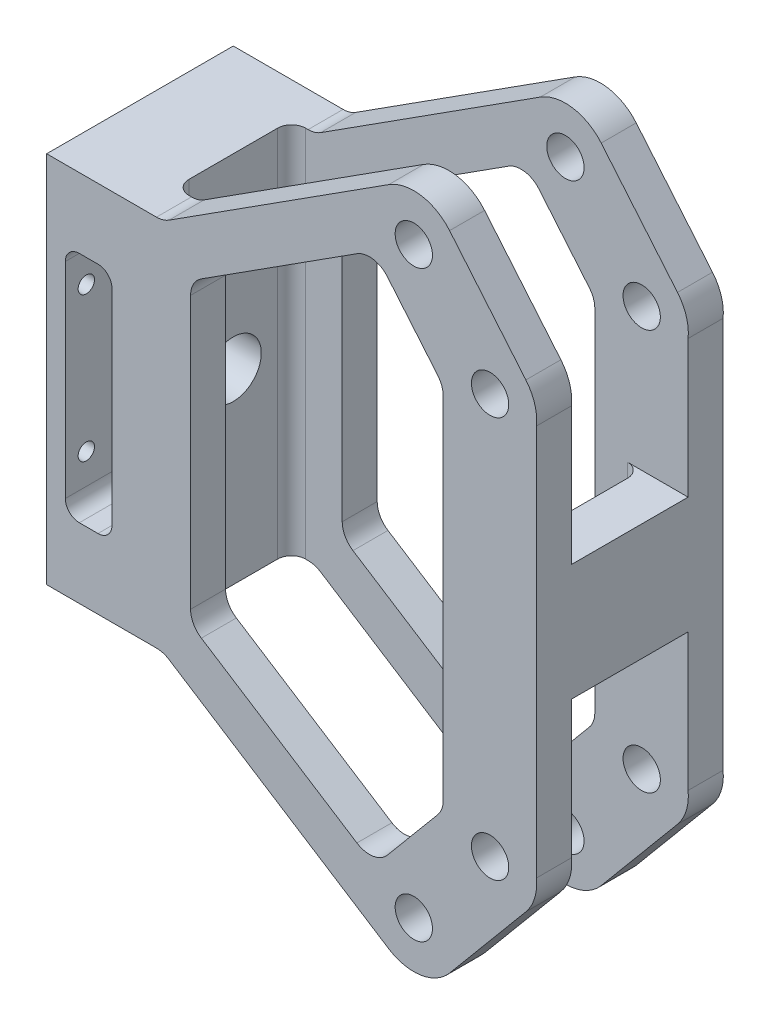
from build123d import *

# Parameters (mm, degrees)
SKETCH1_R               = 4
BOSS_EXTRUDE1_DEPTH     = 40
CUT_EXTRUDE1_DEPTH      = 160.033809299
CUT_EXTRUDE1_DEPTH_BACK = 160.033809299
SKETCH2_W               = 100
SKETCH2_H               = 25
SKETCH3_W               = 25
SKETCH3_H               = 25
BOSS_EXTRUDE2_DEPTH     = 10
SKETCH4_R               = 6
CUT_EXTRUDE2_DEPTH      = 100
FILLET1_R               = 5
FILLET2_R               = 3
SKETCH5_R               = 1.75
CUT_EXTRUDE3_DEPTH      = 10
SKETCH7_W               = 10
SKETCH7_H               = 50
CUT_EXTRUDE4_DEPTH      = 10
FILLET3_R               = 3
FILLET3_OF_MIRROR1_R    = 3


with BuildPart() as part:
    # Sketch1 → Boss-Extrude1 (new body)
    with BuildSketch(Plane.XY):
        with BuildLine():
            Line((25, 0), (73.308886978, -30.922345302))
            ThreePointArc((73.308886978, -30.922345302), (80.218691228, -32.384006119), (86.370944241, -28.915342115))
            Line((86.370944241, -28.915342115), (102.720944241, -9.365342115))
            ThreePointArc((102.720944241, -9.365342115), (104.608588105, -5.888263678), (105, -1.951250782))
            Line((105, -1.951250782), (105, 0))
            Line((105, 0), (105, 80))
            Line((105, 80), (105, 81.951250782))
            ThreePointArc((105, 81.951250782), (104.608588105, 85.888263678), (102.720944241, 89.365342115))
            Line((102.720944241, 89.365342115), (86.370944241, 108.915342115))
            ThreePointArc((86.370944241, 108.915342115), (80.218691228, 112.384006119), (73.308886978, 110.922345302))
            Line((73.308886978, 110.922345302), (25, 80))
            Line((25, 80), (0, 80))
            Line((0, 80), (0, 0))
            Line((0, 0), (25, 0))
        make_face()
        with Locations((78.7, -22.5)):
            Circle(SKETCH1_R, mode=Mode.SUBTRACT)
        with Locations((95.05, -2.95)):
            Circle(SKETCH1_R, mode=Mode.SUBTRACT)
        with Locations(Location((78.7, 102.5, 0), (0, 0, 180))):
            Circle(SKETCH1_R, mode=Mode.SUBTRACT)
        with Locations(Location((95.05, 82.95, 0), (0, 0, 180))):
            Circle(SKETCH1_R, mode=Mode.SUBTRACT)
        Polygon((30.852797713, 71.873177413), (30.852797713, 8.126822587), (70.209148437, -17.065036365), (85, 0.620660764), (85, 79.379339236), (70.209148437, 97.065036365), align=None, mode=Mode.SUBTRACT)
    extrude(amount=-BOSS_EXTRUDE1_DEPTH)

    # Sketch2 → Cut-Extrude1 (cut, two sides: drawn at the far end of the back side and taken through both)
    with BuildSketch(Plane(origin=(0, 0, 0), x_dir=(1, 0, 0), z_dir=(0, 1, 0)).offset(-CUT_EXTRUDE1_DEPTH_BACK)):
        with Locations((70, 20)):
            Rectangle(SKETCH2_W, SKETCH2_H)
    extrude(amount=CUT_EXTRUDE1_DEPTH + CUT_EXTRUDE1_DEPTH_BACK, mode=Mode.SUBTRACT)

    # Sketch3 → Boss-Extrude2 (add)
    with BuildSketch(Plane(origin=(105, 0, 0), x_dir=(0, 0, -1), z_dir=(1, 0, 0))):
        with Locations((20, 40)):
            Rectangle(SKETCH3_W, SKETCH3_H)
    extrude(amount=-BOSS_EXTRUDE2_DEPTH)

    # Sketch4 → Cut-Extrude2 (cut)
    with BuildSketch(Plane.ZY):
        with Locations((-20, 40)):
            Circle(SKETCH4_R)
    extrude(amount=-CUT_EXTRUDE2_DEPTH, mode=Mode.SUBTRACT)

    # Fillet1
    fillet1_edges = [part.edges().sort_by_distance(p)[0] for p in [
        (25, 80, -3.75),
        (25, 80, -36.25),
        (25, 0, -36.25),
        (85, 79.379339236, -36.25),
        (85, 0.620660764, -36.25),
        (70.209148437, -17.065036365, -36.25),
        (30.852797713, 8.126822587, -36.25),
        (30.852797713, 71.873177413, -36.25),
        (70.209148437, 97.065036365, -36.25),
        (70.209148437, 97.065036365, -3.75),
        (85, 79.379339236, -3.75),
        (30.852797713, 71.873177413, -3.75),
        (30.852797713, 8.126822587, -3.75),
        (70.209148437, -17.065036365, -3.75),
        (85, 0.620660764, -3.75),
        (25, 0, -3.75),
    ]]
    fillet(fillet1_edges, radius=FILLET1_R)

    # Fillet2
    fillet2_edges = [part.edges().sort_by_distance(p)[0] for p in [
        (20, 40, -32.5),
        (20, 40, -7.5),
        (95, 40, -32.5),
        (95, 40, -7.5),
    ]]
    fillet(fillet2_edges, radius=FILLET2_R)

    # Sketch5 → Cut-Extrude3 (cut)
    with BuildSketch(Plane.ZY):
        with Locations((-35.5, 55.5)):
            Circle(SKETCH5_R)
        with Locations((-4.5, 55.5)):
            Circle(SKETCH5_R)
        with Locations((-35.5, 24.5)):
            Circle(SKETCH5_R)
        with Locations((-4.5, 24.5)):
            Circle(SKETCH5_R)
    extrude(amount=-CUT_EXTRUDE3_DEPTH, mode=Mode.SUBTRACT)

    # Sketch7 → Cut-Extrude4 (cut)
    with BuildSketch(Plane.XY):
        with Locations((9, 40)):
            Rectangle(SKETCH7_W, SKETCH7_H)
    cut_extrude4 = extrude(amount=-CUT_EXTRUDE4_DEPTH, mode=Mode.SUBTRACT)

    # Fillet3
    fillet3_edges = [part.edges().sort_by_distance(p)[0] for p in [
        (4, 15, -5),
        (4, 65, -5),
        (14, 65, -5),
        (14, 15, -5),
    ]]
    fillet(fillet3_edges, radius=FILLET3_R)

    # Mirror1: Cut-Extrude4 across plane
    add(cut_extrude4.mirror(Plane.XY.offset(-20)), mode=Mode.SUBTRACT)

    # Fillet3 of Mirror1
    fillet3_of_mirror1_edges = [part.edges().sort_by_distance(p)[0] for p in [
        (4, 15, -35),
        (4, 65, -35),
        (14, 65, -35),
        (14, 15, -35),
    ]]
    fillet(fillet3_of_mirror1_edges, radius=FILLET3_OF_MIRROR1_R)


solid = part.part
